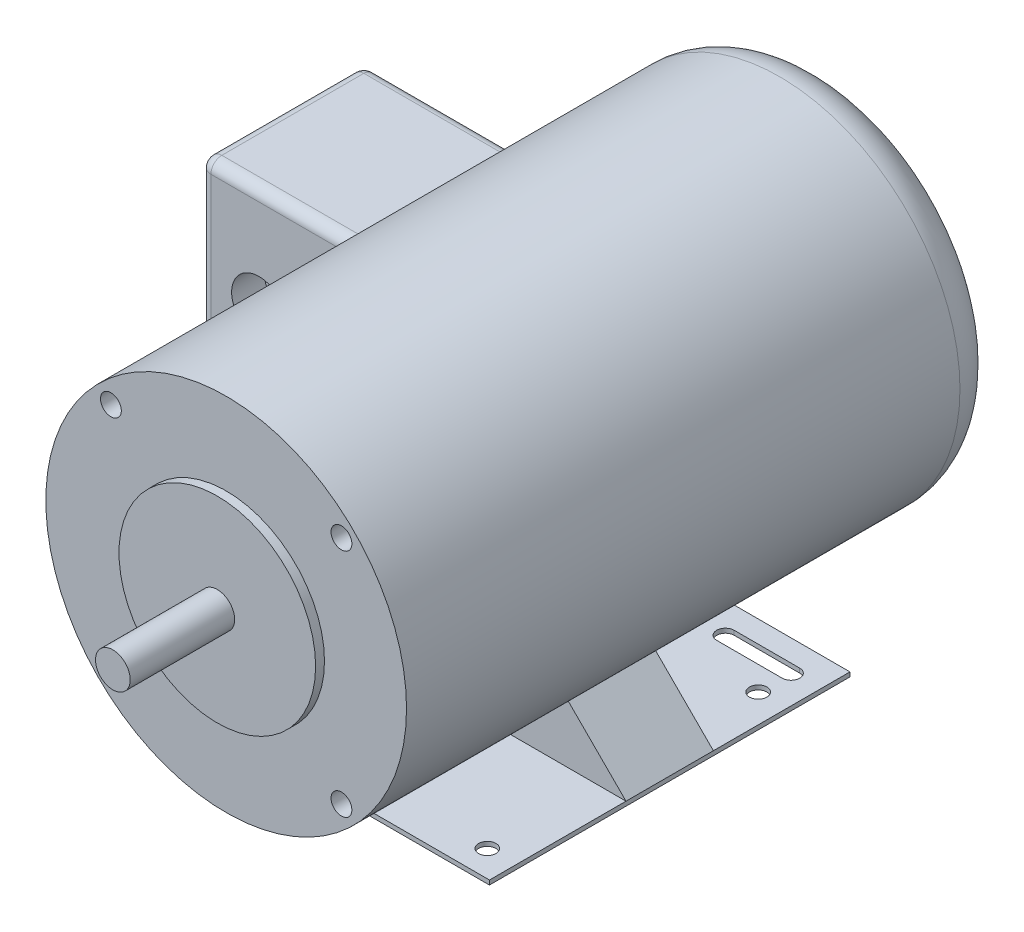
from build123d import *

# Parameters (mm, degrees)
SKETCH1_R                = 82.55
BOSS_EXTRUDE1_DEPTH      = 273.304
SKETCH2_R                = 45
BOSS_EXTRUDE2_DEPTH      = 4.064
SKETCH3_R                = 7.94
BOSS_EXTRUDE3_DEPTH      = 47.8
SKETCH5_W                = 165
SKETCH5_H                = 165
SKETCH5_R                = 4
BOSS_EXTRUDE4_DEPTH      = 2
BOSS_EXTRUDE5_REACH      = 404.315
BOSS_EXTRUDE5_END_RADIUS = 82.55
SKETCH6_W                = 75
SKETCH6_H                = 94
SKETCH7_R                = 4.7625
CUT_EXTRUDE1_DEPTH       = 15
SKETCH8_R                = 12.5
CUT_EXTRUDE2_DEPTH       = 15
BOSS_EXTRUDE6_DEPTH      = 20
BOSS_EXTRUDE6_DEPTH_BACK = 20
FILLET1_R                = 5
FILLET2_R                = 20


with BuildPart() as part:
    # Sketch1 → Boss-Extrude1 (new body)
    with BuildSketch(Plane.XY):
        Circle(SKETCH1_R)
    extrude(amount=BOSS_EXTRUDE1_DEPTH)

    # Sketch2 → Boss-Extrude2 (add)
    with BuildSketch(Plane.XY.offset(273.304)):
        Circle(SKETCH2_R)
    extrude(amount=BOSS_EXTRUDE2_DEPTH)

    # Sketch3 → Boss-Extrude3 (add)
    with BuildSketch(Plane.XY.offset(277.368)):
        with Locations(Location((0, 0, 0), (0, 0, 180))):
            Circle(SKETCH3_R)
    extrude(amount=BOSS_EXTRUDE3_DEPTH)

    # Sketch7 → Cut-Extrude1 (cut)
    with BuildSketch(Plane.XY.offset(273.304)):
        with Locations((52.760772478, 52.760772478)):
            Circle(SKETCH7_R)
        with Locations(Location((52.760772478, -52.760772478, 0), (0, 0, 180))):
            Circle(SKETCH7_R)
        with Locations((-52.760772478, -52.760772478)):
            Circle(SKETCH7_R)
        with Locations(Location((-52.760772478, 52.760772478, 0), (0, 0, 180))):
            Circle(SKETCH7_R)
    extrude(amount=-CUT_EXTRUDE1_DEPTH, mode=Mode.SUBTRACT)



with BuildPart() as body_2:
    # Sketch5 → Boss-Extrude4 (new body)
    with BuildSketch(Plane(origin=(0, -89, 0), x_dir=(1, 0, 0), z_dir=(0, 1, 0))):
        with Locations((0, -152.804)):
            Rectangle(SKETCH5_W, SKETCH5_H)
        with Locations(Location((69.5, -223.304, 0), (0, 0, 270))):
            Circle(SKETCH5_R, mode=Mode.SUBTRACT)
        with Locations(Location((69.5, -99.304, 0), (0, 0, 90))):
            Circle(SKETCH5_R, mode=Mode.SUBTRACT)
        with Locations(Location((-69.5, -99.304, 0), (0, 0, 270))):
            Circle(SKETCH5_R, mode=Mode.SUBTRACT)
        with Locations(Location((-69.5, -223.304, 0), (0, 0, 90))):
            Circle(SKETCH5_R, mode=Mode.SUBTRACT)
        with BuildLine():
            Line((69.5, -88.304), (39.5, -88.304))
            ThreePointArc((39.5, -88.304), (35.5, -84.304), (39.5, -80.304))
            Line((39.5, -80.304), (69.5, -80.304))
            ThreePointArc((69.5, -80.304), (73.5, -84.304), (69.5, -88.304))
        make_face(mode=Mode.SUBTRACT)
        with BuildLine():
            Line((-69.5, -88.304), (-39.5, -88.304))
            ThreePointArc((-39.5, -88.304), (-35.5, -84.304), (-39.5, -80.304))
            Line((-39.5, -80.304), (-69.5, -80.304))
            ThreePointArc((-69.5, -80.304), (-73.5, -84.304), (-69.5, -88.304))
        make_face(mode=Mode.SUBTRACT)
    extrude(amount=BOSS_EXTRUDE4_DEPTH)


with BuildPart() as body_3:
    # Boss-Extrude5: up to this cylinder (the profile starts outside it)
    boss_extrude5_end = Plane(origin=(0, 0, 110.804), z_dir=(0, 0, -1)) * Cylinder(BOSS_EXTRUDE5_END_RADIUS, 974.73, mode=Mode.PRIVATE)
    # Sketch6 → Boss-Extrude5 (new, up to the surface)
    with BuildSketch(Plane(origin=(-137, 0, 0), x_dir=(0, 0, -1), z_dir=(1, 0, 0)), mode=Mode.PRIVATE) as boss_extrude5_sk1:
        with Locations((-110.804, 0)):
            Rectangle(SKETCH6_W, SKETCH6_H)
    boss_extrude5_tool1 = extrude(boss_extrude5_sk1.sketch, amount=BOSS_EXTRUDE5_REACH, mode=Mode.PRIVATE) - boss_extrude5_end
    add(boss_extrude5_tool1.solids().sort_by_distance((-137, 0, 110.804))[0])

    # Sketch8 → Cut-Extrude2 (cut)
    with BuildSketch(Plane.XY.offset(148.304)):
        with Locations((-110, 0)):
            Circle(SKETCH8_R)
    extrude(amount=-CUT_EXTRUDE2_DEPTH, mode=Mode.SUBTRACT)

    # Fillet1
    fillet1_edges = [body_3.edges().sort_by_distance(p)[0] for p in [
        (-137, 0, 73.304),
        (-137, -47, 110.804),
        (-137, 0, 148.304),
        (-137, 47, 110.804),
        (-102.431926338, -47, 73.304),
        (-102.431926338, -47, 148.304),
        (-102.431926338, 47, 148.304),
        (-102.431926338, 47, 73.304),
    ]]
    fillet(fillet1_edges, radius=FILLET1_R)


with BuildPart() as part_1:
    add(part.part)

    add(body_2.part)  # Boss-Extrude6 merges body 2
    # Sketch9 → Boss-Extrude6 (add, two sides: drawn at the far end of the back side and taken through both)
    with BuildSketch(Plane.XY.offset(152.804).offset(-BOSS_EXTRUDE6_DEPTH_BACK)):
        with BuildLine():
            Line((-56.078284305, -60.578284305), (-82.5, -87))
            Line((-82.5, -87), (82.5, -87))
            Line((82.5, -87), (56.078284305, -60.578284305))
            ThreePointArc((56.078284305, -60.578284305), (0, -82.55), (-56.078284305, -60.578284305))
        make_face()
    extrude(amount=BOSS_EXTRUDE6_DEPTH + BOSS_EXTRUDE6_DEPTH_BACK)

    # Fillet2
    fillet2_edges = [part_1.edges().sort_by_distance(p)[0] for p in [
        (-82.55, 0, 0),
    ]]
    fillet(fillet2_edges, radius=FILLET2_R)


solid = Compound([body_3.part, part_1.part])
